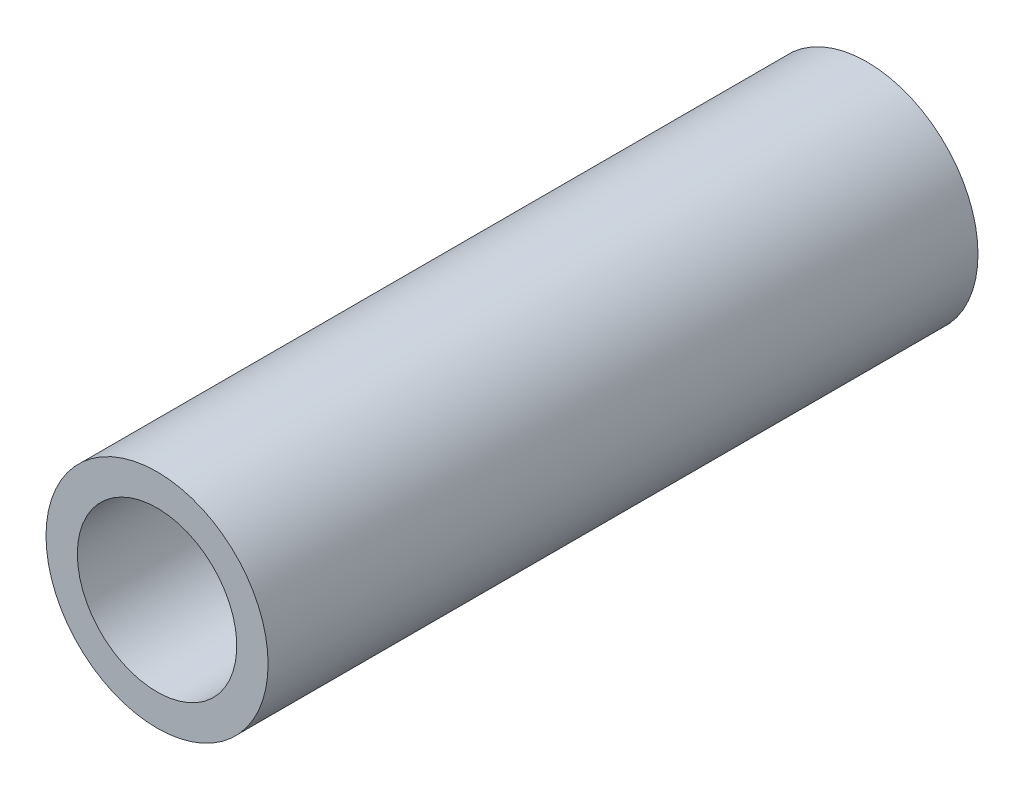
from build123d import *

# Parameters (mm, degrees)
SKETCH2_R      = 14
SKETCH2_R_2    = 10.05
EXTRUDE1_DEPTH = 89.5


with BuildPart() as part:
    # Sketch2 → Extrude1 (new body)
    with BuildSketch(Plane.XY):
        with Locations(Location((0, 0, 0), (0, 0, 180))):
            Circle(SKETCH2_R)
        with Locations(Location((0, 0, 0), (0, 0, 180))):
            Circle(SKETCH2_R_2, mode=Mode.SUBTRACT)
    extrude(amount=EXTRUDE1_DEPTH)


solid = part.part
